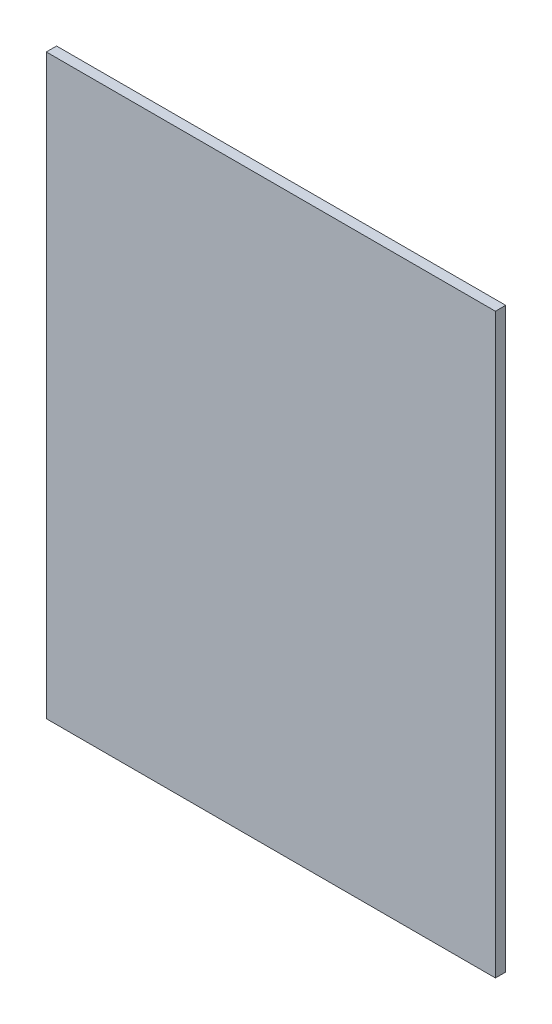
from build123d import *

# Parameters (mm, degrees)
SKETCH1_W           = 70
SKETCH1_H           = 90
BOSS_EXTRUDE1_DEPTH = 1.6


with BuildPart() as part:
    # Sketch1 → Boss-Extrude1 (new body)
    with BuildSketch(Plane.XY.offset(9)):
        with Locations((0, 32.5)):
            Rectangle(SKETCH1_W, SKETCH1_H)
    extrude(amount=BOSS_EXTRUDE1_DEPTH)


solid = part.part
